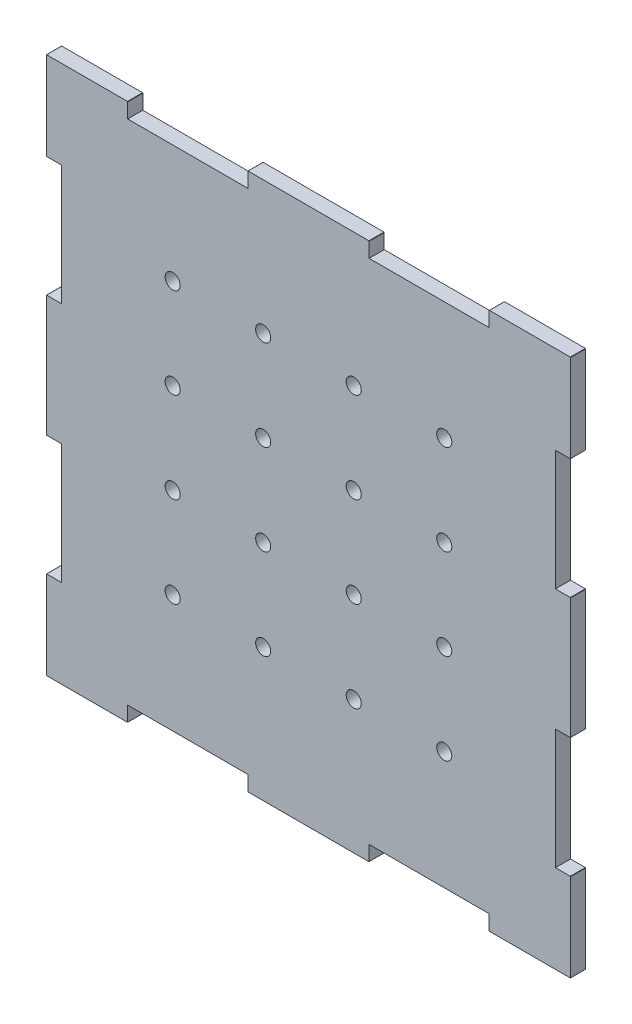
from build123d import *

# Parameters (mm, degrees)
BOSS_EXTRUDE1_DEPTH = 5
SKETCH2_R           = 2.5
CUT_EXTRUDE1_DEPTH  = 125.526031415


with BuildPart() as part:
    # Model → Boss-Extrude1 (new body)
    with BuildSketch(Plane.XY):
        Polygon((-59.94, -89.08), (-59.93, -89.07), (-59.92, -89.05), (-59.91, -89.04), (-59.9, -89.02), (-59.9, -84.1), (-20.1, -84.1), (-20.1, -89.02), (-20.08, -89.06), (-20.07, -89.07), (-20.05, -89.08), (-20.04, -89.09), (-20.02, -89.1), (20.02, -89.1), (20.06, -89.08), (20.07, -89.07), (20.08, -89.05), (20.09, -89.04), (20.1, -89.02), (20.1, -84.1), (59.9, -84.1), (59.9, -89.02), (59.92, -89.06), (59.93, -89.07), (59.95, -89.08), (59.96, -89.09), (59.98, -89.1), (86.77, -89.1), (86.81, -89.08), (86.82, -89.07), (86.83, -89.05), (86.84, -89.04), (86.85, -89.02), (86.85, -59.98), (86.83, -59.94), (86.82, -59.93), (86.8, -59.92), (86.79, -59.91), (86.77, -59.9), (81.85, -59.9), (81.85, -20.1), (86.77, -20.1), (86.81, -20.08), (86.82, -20.07), (86.83, -20.05), (86.84, -20.04), (86.85, -20.02), (86.85, 20.02), (86.83, 20.06), (86.82, 20.07), (86.8, 20.08), (86.79, 20.09), (86.77, 20.1), (81.85, 20.1), (81.85, 59.9), (86.77, 59.9), (86.81, 59.92), (86.82, 59.93), (86.83, 59.95), (86.84, 59.96), (86.85, 59.98), (86.85, 89.02), (86.83, 89.06), (86.82, 89.07), (86.8, 89.08), (86.79, 89.09), (86.77, 89.1), (59.98, 89.1), (59.94, 89.08), (59.93, 89.07), (59.92, 89.05), (59.91, 89.04), (59.9, 89.02), (59.9, 84.1), (20.1, 84.1), (20.1, 89.02), (20.08, 89.06), (20.07, 89.07), (20.05, 89.08), (20.04, 89.09), (20.02, 89.1), (-20.02, 89.1), (-20.06, 89.08), (-20.07, 89.07), (-20.08, 89.05), (-20.09, 89.04), (-20.1, 89.02), (-20.1, 84.1), (-59.9, 84.1), (-59.9, 89.02), (-59.92, 89.06), (-59.93, 89.07), (-59.95, 89.08), (-59.96, 89.09), (-59.98, 89.1), (-86.77, 89.1), (-86.81, 89.08), (-86.82, 89.07), (-86.83, 89.05), (-86.84, 89.04), (-86.85, 89.02), (-86.85, 59.98), (-86.83, 59.94), (-86.82, 59.93), (-86.8, 59.92), (-86.79, 59.91), (-86.77, 59.9), (-81.85, 59.9), (-81.85, 20.1), (-86.77, 20.1), (-86.81, 20.08), (-86.82, 20.07), (-86.83, 20.05), (-86.84, 20.04), (-86.85, 20.02), (-86.85, -20.02), (-86.83, -20.06), (-86.82, -20.07), (-86.8, -20.08), (-86.79, -20.09), (-86.77, -20.1), (-81.85, -20.1), (-81.85, -59.9), (-86.77, -59.9), (-86.81, -59.92), (-86.82, -59.93), (-86.83, -59.95), (-86.84, -59.96), (-86.85, -59.98), (-86.85, -89.02), (-86.83, -89.06), (-86.82, -89.07), (-86.8, -89.08), (-86.79, -89.09), (-86.77, -89.1), (-59.98, -89.1), align=None)
    extrude(amount=BOSS_EXTRUDE1_DEPTH)

    # Sketch2 → Cut-Extrude1 (cut, through all)
    with BuildSketch(Plane.XY.offset(5)):
        with Locations((-45, 45)):
            Circle(SKETCH2_R)
        with Locations((-15, 45)):
            Circle(SKETCH2_R)
        with Locations((15, 45)):
            Circle(SKETCH2_R)
        with Locations((45, 45)):
            Circle(SKETCH2_R)
        with Locations((-15, 15)):
            Circle(SKETCH2_R)
        with Locations((15, 15)):
            Circle(SKETCH2_R)
        with Locations((45, 15)):
            Circle(SKETCH2_R)
        with Locations((-15, -15)):
            Circle(SKETCH2_R)
        with Locations((15, -15)):
            Circle(SKETCH2_R)
        with Locations((45, -15)):
            Circle(SKETCH2_R)
        with Locations((-15, -45)):
            Circle(SKETCH2_R)
        with Locations((15, -45)):
            Circle(SKETCH2_R)
        with Locations((45, -45)):
            Circle(SKETCH2_R)
        with Locations((-45, 15)):
            Circle(SKETCH2_R)
        with Locations((-45, -15)):
            Circle(SKETCH2_R)
        with Locations((-45, -45)):
            Circle(SKETCH2_R)
    extrude(amount=-CUT_EXTRUDE1_DEPTH, mode=Mode.SUBTRACT)


solid = part.part
